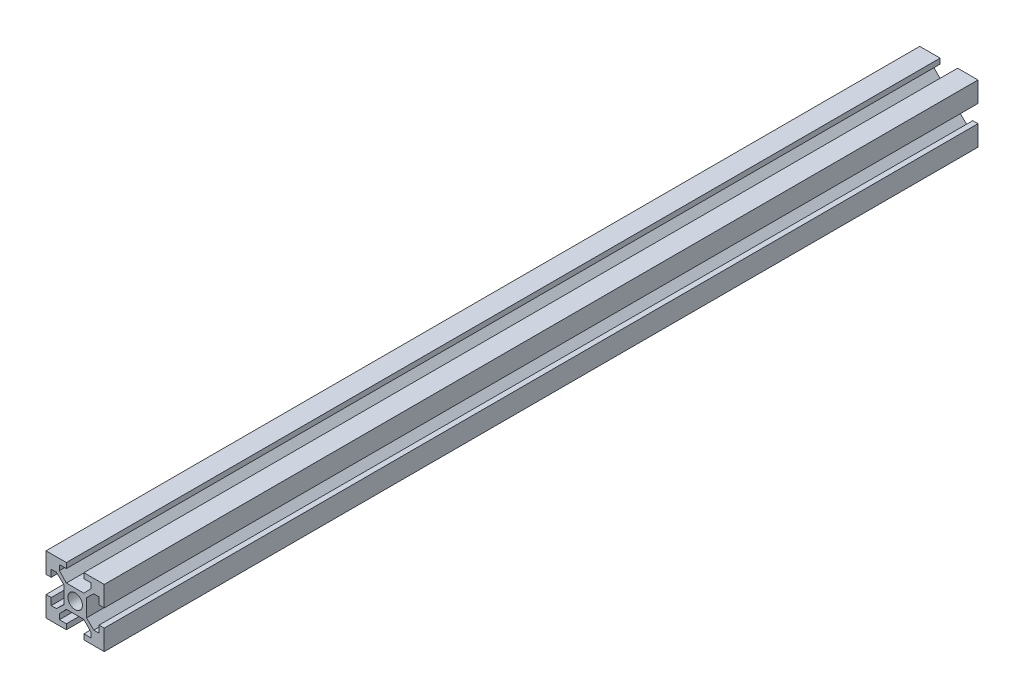
from build123d import *

# Parameters (mm, degrees)
SKETCH2_R           = 2.5
BOSS_EXTRUDE1_DEPTH = 300


with BuildPart() as part:
    # Sketch2 → Boss-Extrude1 (new body)
    with BuildSketch(Plane.XY):
        Polygon((7, -1.8), (7, 0), (0, 0), (0, -7), (0.4, -7), (1.8, -7), (1.8, -4.6), (2.2, -4.6), (3.6, -4.6), (6.1, -7), (6.1, -13), (3.6, -15.4), (1.8, -15.4), (1.8, -13), (0.4, -13), (0, -13), (0, -20), (7, -20), (7, -18.2), (4.6, -18.2), (4.6, -16.4), (7, -13.9), (7.016, -13.9), (13, -13.9), (15.4, -16.4), (15.4, -18.2), (13, -18.2), (13, -19.6), (13, -20), (20, -20), (20, -13), (18.2, -13), (18.2, -15), (18.2, -15.4), (16.4, -15.4), (13.9, -13), (13.9, -12.6), (13.9, -7), (16.4, -4.6), (18.2, -4.6), (18.2, -7), (20, -7), (20, -6.6), (20, 0), (13, 0), (13, -1.8), (15.4, -1.8), (15.4, -3.6), (13, -6.1), (7, -6.1), (4.6, -3.6), (4.6, -1.8), align=None)
        with Locations((10, -10)):
            Circle(SKETCH2_R, mode=Mode.SUBTRACT)
    extrude(amount=BOSS_EXTRUDE1_DEPTH)


solid = part.part
